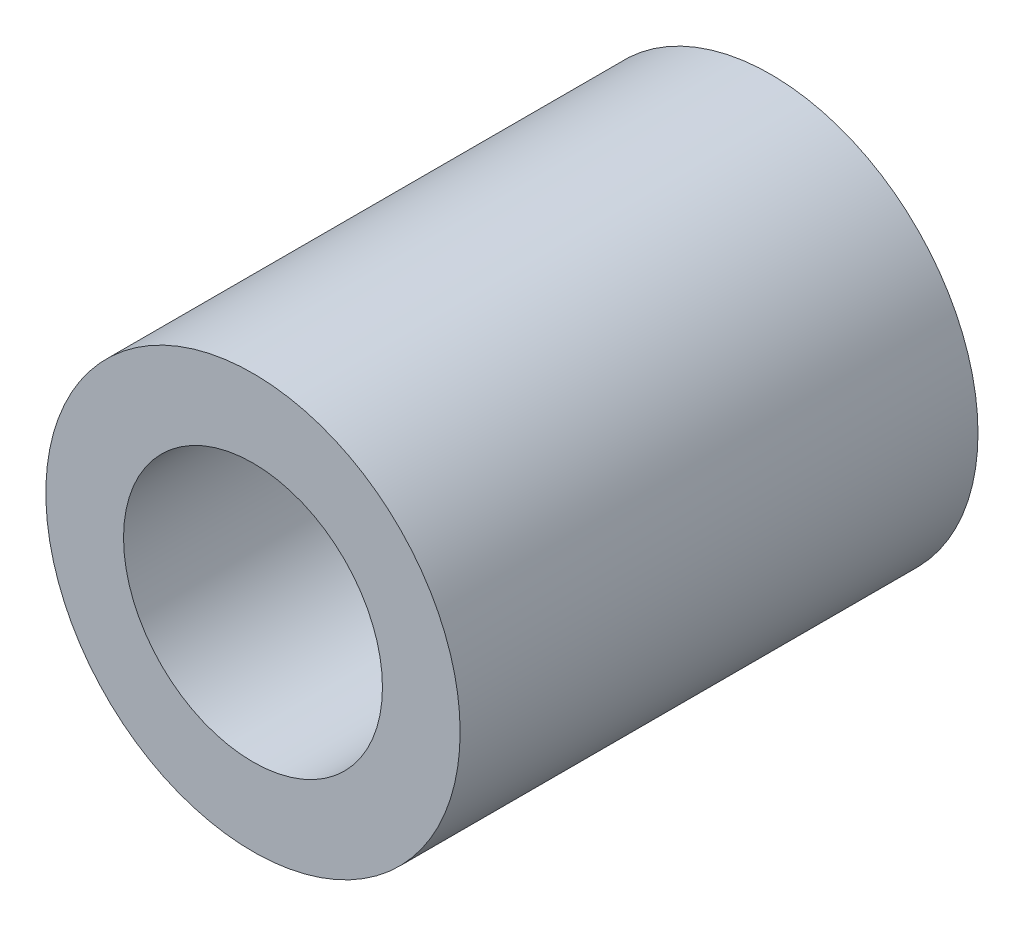
from build123d import *

# Parameters (mm, degrees)
SKETCH_1_R                                 = 2
SKETCH_1_R_2                               = 1.25
KNURL_OD4_LENGTH5_M3_THREAD_ENVELOPE_DEPTH = 5


with BuildPart() as part:
    # 草图1 → Knurl_OD4_length5_M3_thread_envelope (new body)
    with BuildSketch(Plane.XY):
        Circle(SKETCH_1_R)
        Circle(SKETCH_1_R_2, mode=Mode.SUBTRACT)
    extrude(amount=KNURL_OD4_LENGTH5_M3_THREAD_ENVELOPE_DEPTH)


solid = part.part
